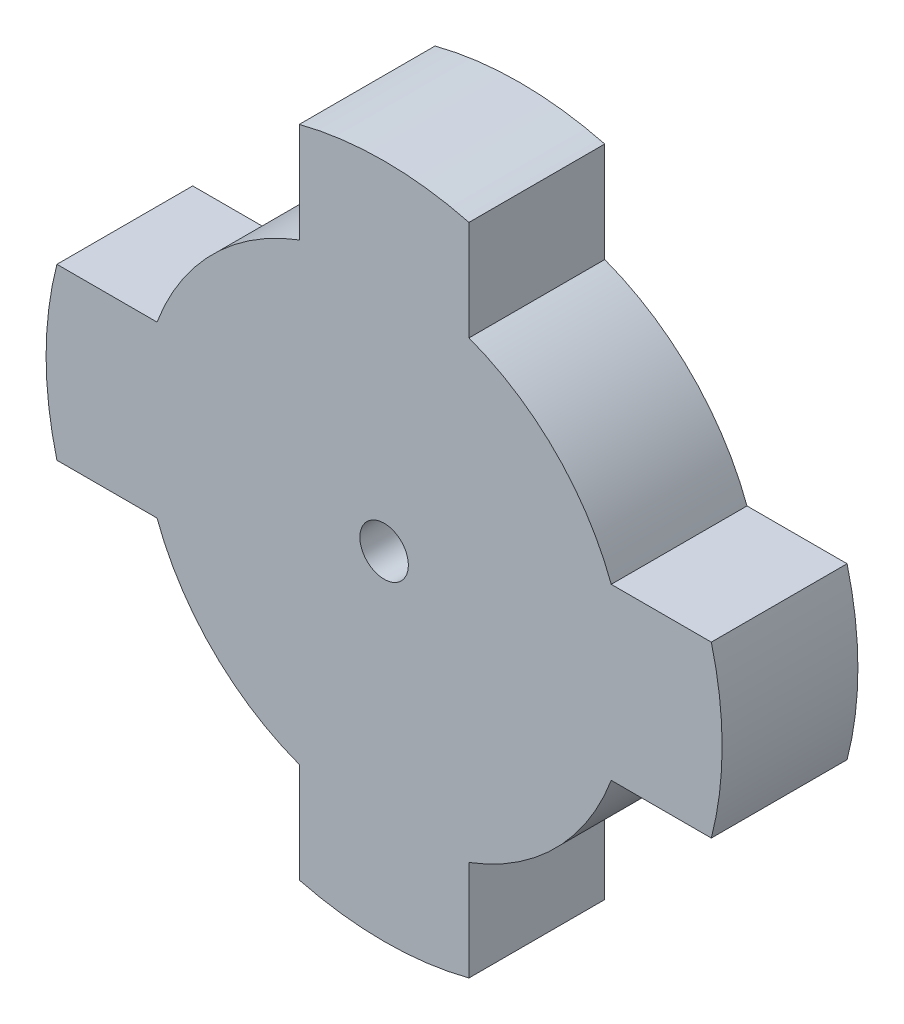
from build123d import *

# Parameters (mm, degrees)
ROTOR_SKETCH_R = 2.5
ROTOR_DEPTH    = 14


with BuildPart() as part:
    # Rotor_Sketch → Rotor (new body)
    with BuildSketch(Plane.XY):
        with BuildLine():
            Line((-8.75, 33.737818734), (-8.75, 23.418742494))
            ThreePointArc((-8.75, 23.418742494), (-17.67766953, 17.67766953), (-23.418742494, 8.75))
            Line((-23.418742494, 8.75), (-33.737818734, 8.75))
            ThreePointArc((-33.737818734, 8.75), (-34.854022909, 0), (-33.737818734, -8.75))
            Line((-33.737818734, -8.75), (-23.418742494, -8.75))
            ThreePointArc((-23.418742494, -8.75), (-17.67766953, -17.67766953), (-8.75, -23.418742494))
            Line((-8.75, -23.418742494), (-8.75, -33.737818734))
            ThreePointArc((-8.75, -33.737818734), (0, -34.854022909), (8.75, -33.737818734))
            Line((8.75, -33.737818734), (8.75, -23.418742494))
            ThreePointArc((8.75, -23.418742494), (17.67766953, -17.67766953), (23.418742494, -8.75))
            Line((23.418742494, -8.75), (33.737818734, -8.75))
            ThreePointArc((33.737818734, -8.75), (34.854022909, 0), (33.737818734, 8.75))
            Line((33.737818734, 8.75), (23.418742494, 8.75))
            ThreePointArc((23.418742494, 8.75), (17.67766953, 17.67766953), (8.75, 23.418742494))
            Line((8.75, 23.418742494), (8.75, 33.737818734))
            ThreePointArc((8.75, 33.737818734), (0, 34.854022909), (-8.75, 33.737818734))
        make_face()
        Circle(ROTOR_SKETCH_R, mode=Mode.SUBTRACT)
    extrude(amount=ROTOR_DEPTH)


solid = part.part
